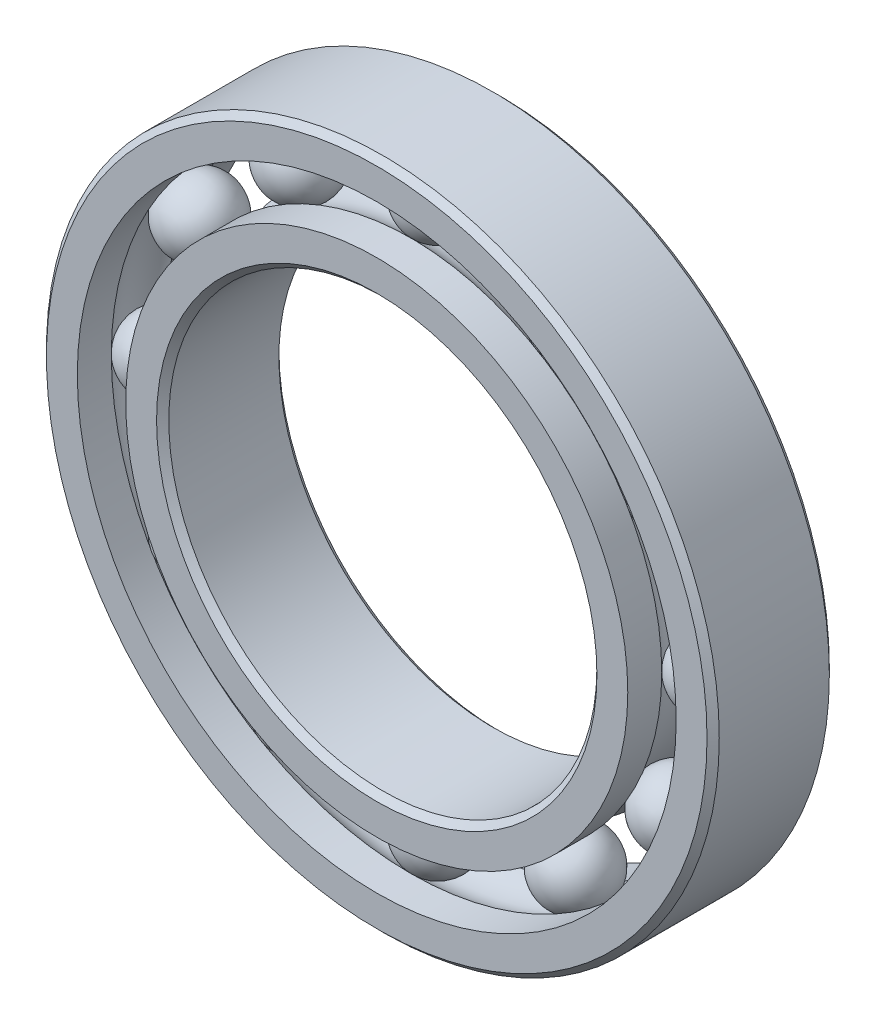
from build123d import *

# Parameters (mm, degrees)
CIRPATTERN1_COUNT = 12


with BuildPart() as part:
    # Sketch1 → Revolve1 (revolve)
    with BuildSketch(Plane(origin=(0, 0, 0), x_dir=(0, 0, -1), z_dir=(1, 0, 0))):
        with BuildLine():
            Line((4.5, 27.5), (-4.5, 27.5))
            Line((-4.5, 27.5), (-5, 27))
            Line((-5, 27), (-5, 24.477771978))
            Line((-5, 24.477771978), (-2.222222222, 24.477771978))
            ThreePointArc((-2.222222222, 24.477771978), (0, 25.474786563), (2.222222222, 24.477771978))
            Line((2.222222222, 24.477771978), (5, 24.477771978))
            Line((5, 24.477771978), (5, 27))
            Line((5, 27), (4.5, 27.5))
        make_face()
    revolve(axis=Axis((0, 0, 5), (0, 0, -1)))


with BuildPart() as body_2:
    # Sketch3 → Revolve3 (revolve)
    with BuildSketch(Plane(origin=(0, 0, 0), x_dir=(0, 0, -1), z_dir=(1, 0, 0))):
        with BuildLine():
            Line((-5, 20.521728022), (-2.222222222, 20.521728022))
            ThreePointArc((-2.222222222, 20.521728022), (0, 19.524713437), (2.222222222, 20.521728022))
            Line((2.222222222, 20.521728022), (5, 20.521728022))
            Line((5, 20.521728022), (5, 17.9995))
            Line((5, 17.9995), (4.5, 17.4995))
            Line((4.5, 17.4995), (-4.5, 17.4995))
            Line((-4.5, 17.4995), (-5, 17.9995))
            Line((-5, 17.9995), (-5, 20.521728022))
        make_face()
    revolve(axis=Axis((0, 0, 5), (0, 0, -1)))


with BuildPart() as body_3:
    # Sketch4 → Revolve4 (revolve)
    with BuildSketch(Plane(origin=(0, 0, 0), x_dir=(0, 0, -1), z_dir=(1, 0, 0))):
        with BuildLine():
            Line((-2.975036563, 22.49975), (2.975036563, 22.49975))
            ThreePointArc((2.975036563, 22.49975), (0, 25.474786563), (-2.975036563, 22.49975))
        make_face()
    revolve(axis=Axis((0, 22.49975, 2.975036563), (0, 0, -1)))


with BuildPart() as cirpattern1_1:
    # CirPattern1: pattern copy
    add(body_3.part.rotate(Axis((0, 0, -5), (0, 0, 1)), 1 * 360 / CIRPATTERN1_COUNT))


with BuildPart() as cirpattern1_2:
    # CirPattern1: pattern copy
    add(body_3.part.rotate(Axis((0, 0, -5), (0, 0, 1)), 2 * 360 / CIRPATTERN1_COUNT))


with BuildPart() as cirpattern1_3:
    # CirPattern1: pattern copy
    add(body_3.part.rotate(Axis((0, 0, -5), (0, 0, 1)), 3 * 360 / CIRPATTERN1_COUNT))


with BuildPart() as cirpattern1_4:
    # CirPattern1: pattern copy
    add(body_3.part.rotate(Axis((0, 0, -5), (0, 0, 1)), 4 * 360 / CIRPATTERN1_COUNT))


with BuildPart() as cirpattern1_5:
    # CirPattern1: pattern copy
    add(body_3.part.rotate(Axis((0, 0, -5), (0, 0, 1)), 5 * 360 / CIRPATTERN1_COUNT))


with BuildPart() as cirpattern1_6:
    # CirPattern1: pattern copy
    add(body_3.part.rotate(Axis((0, 0, -5), (0, 0, 1)), 6 * 360 / CIRPATTERN1_COUNT))


with BuildPart() as cirpattern1_7:
    # CirPattern1: pattern copy
    add(body_3.part.rotate(Axis((0, 0, -5), (0, 0, 1)), 7 * 360 / CIRPATTERN1_COUNT))


with BuildPart() as cirpattern1_8:
    # CirPattern1: pattern copy
    add(body_3.part.rotate(Axis((0, 0, -5), (0, 0, 1)), 8 * 360 / CIRPATTERN1_COUNT))


with BuildPart() as cirpattern1_9:
    # CirPattern1: pattern copy
    add(body_3.part.rotate(Axis((0, 0, -5), (0, 0, 1)), 9 * 360 / CIRPATTERN1_COUNT))


with BuildPart() as cirpattern1_10:
    # CirPattern1: pattern copy
    add(body_3.part.rotate(Axis((0, 0, -5), (0, 0, 1)), 10 * 360 / CIRPATTERN1_COUNT))


with BuildPart() as cirpattern1_11:
    # CirPattern1: pattern copy
    add(body_3.part.rotate(Axis((0, 0, -5), (0, 0, 1)), 11 * 360 / CIRPATTERN1_COUNT))


solid = Compound([part.part, body_2.part, body_3.part, cirpattern1_1.part, cirpattern1_2.part, cirpattern1_3.part, cirpattern1_4.part, cirpattern1_5.part, cirpattern1_6.part, cirpattern1_7.part, cirpattern1_8.part, cirpattern1_9.part, cirpattern1_10.part, cirpattern1_11.part])
